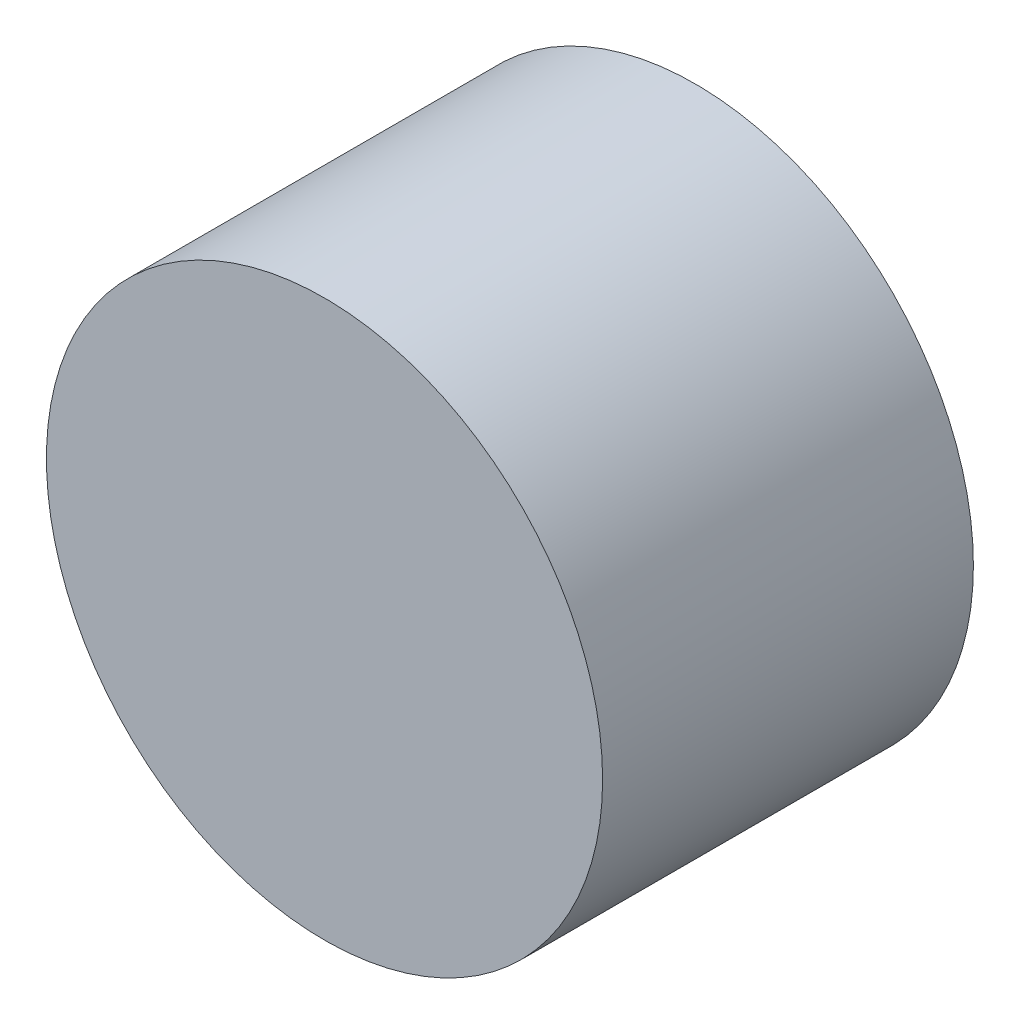
from build123d import *

# Parameters (mm, degrees)
SKETCH1_R                   = 6
RETAINING_CAP_12OD_8L_DEPTH = 8
BLIND_AXLE_SOCKET_8P4_START = -0.1
SKETCH2_R                   = 4.2
BLIND_AXLE_SOCKET_8P4_DEPTH = 5.6


with BuildPart() as part:
    # Sketch1 → Retaining_Cap_12OD_8L (new body)
    with BuildSketch(Plane.XY):
        Circle(SKETCH1_R)
    extrude(amount=RETAINING_CAP_12OD_8L_DEPTH)

    # Sketch2 → Blind_Axle_Socket_8p4 (cut)
    with BuildSketch(Plane.XY.offset(BLIND_AXLE_SOCKET_8P4_START)):
        Circle(SKETCH2_R)
    extrude(amount=BLIND_AXLE_SOCKET_8P4_DEPTH, mode=Mode.SUBTRACT)


solid = part.part
